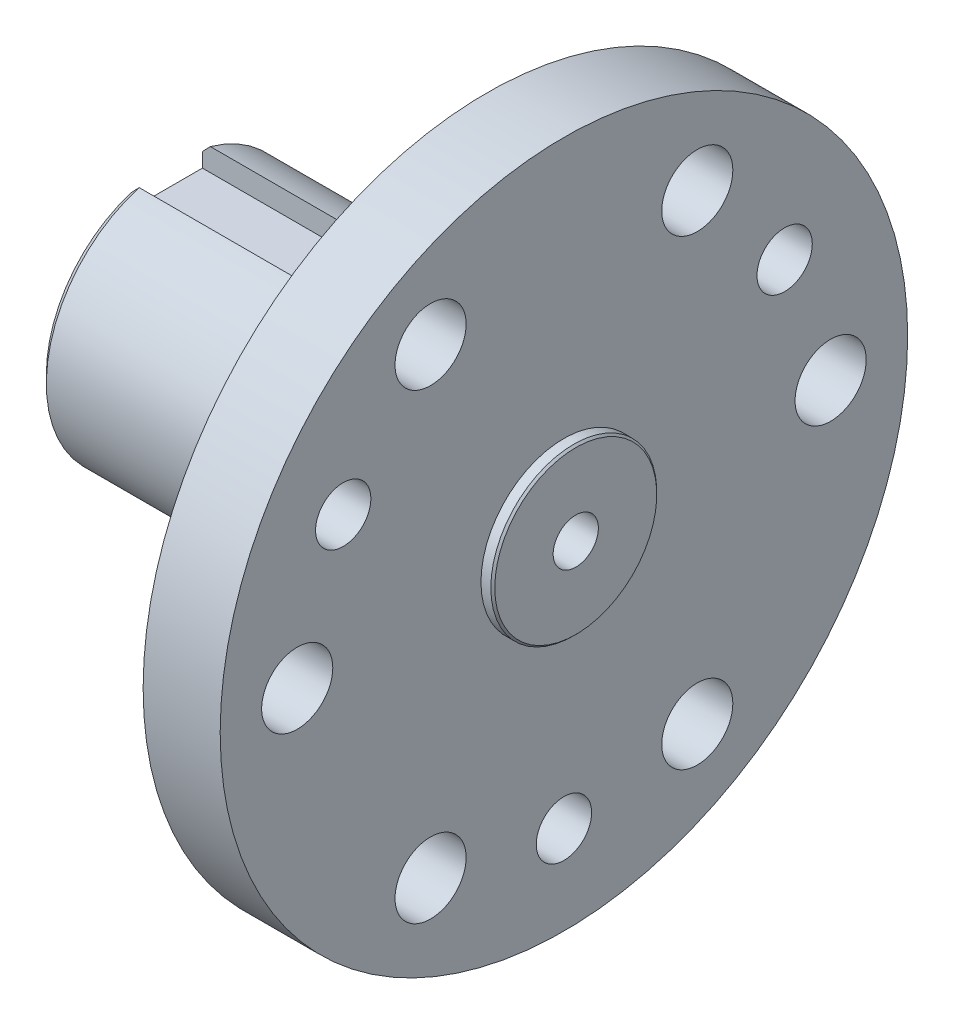
from build123d import *

# Parameters (mm, degrees)
FILLET_1_R               = 2
CHAMFER_1_SIZE           = 2
CHAMFER_2_SIZE           = 0.5
SKETCH_4_R               = 15
CUT_EXTRUDE_3_DEPTH      = 20
CHAMFER_3_SIZE           = 3
CUT_EXTRUDE_4_DEPTH      = 161.780129369
CUT_EXTRUDE_4_DEPTH_BACK = 161.780129369
SKETCH_5_R               = 5.7226
CUT_EXTRUDE_5_DEPTH      = 14.5
CUT_EXTRUDE_6_DEPTH      = 161.780129369
CUT_EXTRUDE_6_DEPTH_BACK = 161.780129369
SKETCH_7_R               = 9
SKETCH_7_R_2             = 7


with BuildPart() as part:
    # ｽｹｯﾁ1 → 回転1 (revolve)
    with BuildSketch(Plane.XY, mode=Mode.PRIVATE) as revolve_1_sk:
        Polygon((0, 0), (0, 32.5), (81, 32.5), (81, 87), (100.5, 87), (100.5, 21), (103.5, 21), (103.5, 0), align=None)
    revolve(revolve_1_sk.sketch.rotate(Axis((0, 0, 0), (1, 0, 0)), 90), axis=Axis((0, 0, 0), (1, 0, 0)))

    # ﾌｨﾚｯﾄ1
    fillet_1_edges = [part.edges().sort_by_distance(p)[0] for p in [
        (81, 0, -32.5),
    ]]
    fillet(fillet_1_edges, radius=FILLET_1_R)

    # 面取り1
    chamfer_1_edges = [part.edges().sort_by_distance(p)[0] for p in [
        (0, 0, -32.5),
    ]]
    chamfer(chamfer_1_edges, length=CHAMFER_1_SIZE)

    # 面取り2
    chamfer_2_edges = [part.edges().sort_by_distance(p)[0] for p in [
        (103.5, 0, -21),
    ]]
    chamfer(chamfer_2_edges, length=CHAMFER_2_SIZE)

    # ｽｹｯﾁ4 → ｶｯﾄ - 押し出し3 (cut)
    with BuildSketch(Plane(origin=(0, 0, 0), x_dir=(0, 0, -1), z_dir=(1, 0, 0))):
        Circle(SKETCH_4_R)
    extrude(amount=CUT_EXTRUDE_3_DEPTH, mode=Mode.SUBTRACT)

    # 面取り3
    chamfer_3_edges = [part.edges().sort_by_distance(p)[0] for p in [
        (0, 0, 15),
    ]]
    chamfer(chamfer_3_edges, length=CHAMFER_3_SIZE)

    # ｽｹｯﾁ5 → ｶｯﾄ - 押し出し4 (cut, two sides: drawn at the far end of the back side and taken through both)
    with BuildSketch(Plane(origin=(0, 0, 0), x_dir=(0, 0, -1), z_dir=(1, 0, 0)).offset(-CUT_EXTRUDE_4_DEPTH_BACK)):
        Circle(SKETCH_5_R)
    extrude(amount=CUT_EXTRUDE_4_DEPTH + CUT_EXTRUDE_4_DEPTH_BACK, mode=Mode.SUBTRACT)

    # ｽｹｯﾁ6 → ｶｯﾄ - 押し出し5 (cut)
    with BuildSketch(Plane(origin=(0, 40, 0), x_dir=(1, 0, 0), z_dir=(0, 1, 0))):
        with BuildLine():
            Line((-5, 9), (57, 9))
            ThreePointArc((57, 9), (66, 0), (57, -9))
            Line((57, -9), (-5, -9))
            ThreePointArc((-5, -9), (-14, 0), (-5, 9))
        make_face()
    extrude(amount=-CUT_EXTRUDE_5_DEPTH, mode=Mode.SUBTRACT)

    # ｽｹｯﾁ7 → ｶｯﾄ - 押し出し6 (cut, two sides: drawn at the far end of the back side and taken through both)
    with BuildSketch(Plane(origin=(0, 0, 0), x_dir=(0, 0, -1), z_dir=(1, 0, 0)).offset(-CUT_EXTRUDE_6_DEPTH_BACK)):
        with Locations((67.5, 0)):
            Circle(SKETCH_7_R)
        with Locations((33.75, 58.456714755)):
            Circle(SKETCH_7_R)
        with Locations((-33.75, 58.456714755)):
            Circle(SKETCH_7_R)
        with Locations((-67.5, 0)):
            Circle(SKETCH_7_R)
        with Locations((-33.75, -58.456714755)):
            Circle(SKETCH_7_R)
        with Locations((33.75, -58.456714755)):
            Circle(SKETCH_7_R)
        with Locations((55.858638544, 32.25)):
            Circle(SKETCH_7_R_2)
        with Locations((-55.858638544, 32.25)):
            Circle(SKETCH_7_R_2)
        with Locations((0, -64.5)):
            Circle(SKETCH_7_R_2)
    extrude(amount=CUT_EXTRUDE_6_DEPTH + CUT_EXTRUDE_6_DEPTH_BACK, mode=Mode.SUBTRACT)


solid = part.part
